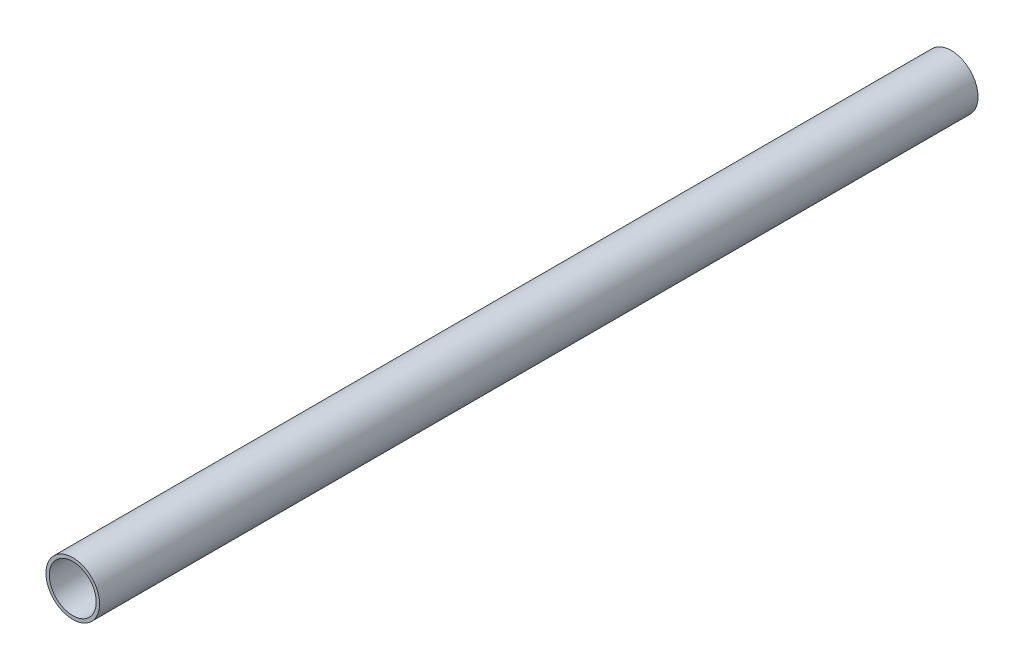
from build123d import *

# Parameters (mm, degrees)
SKETCH1_R               = 8
SKETCH2_R               = 8
CUT_EXTRUDE2_DEPTH      = 263.244161147
CUT_EXTRUDE2_DEPTH_BACK = 263.244161147
SKETCH3_R               = 7


with BuildPart() as part:
    # Sketch1 → Loft3 section 0
    with BuildSketch(Plane.XY):
        Circle(SKETCH1_R)
    # Sketch2 → Loft3 section 1
    with BuildSketch(Plane.XY.offset(262)):
        Circle(SKETCH2_R)
    loft()

    # Sketch3 → Cut-Extrude2 (cut, two sides: drawn at the far end of the back side and taken through both)
    with BuildSketch(Plane.XY.offset(-CUT_EXTRUDE2_DEPTH_BACK)):
        Circle(SKETCH3_R)
    extrude(amount=CUT_EXTRUDE2_DEPTH + CUT_EXTRUDE2_DEPTH_BACK, mode=Mode.SUBTRACT)


solid = part.part
